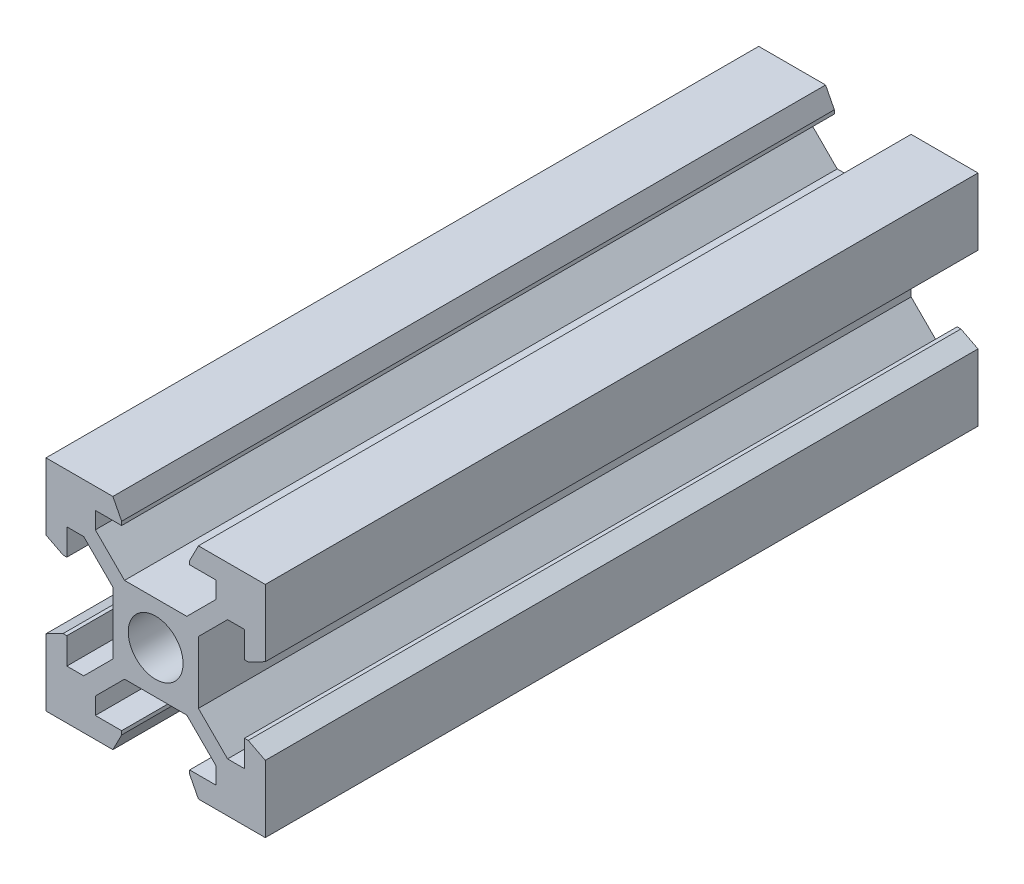
from build123d import *

# Parameters (mm, degrees)
SKETCH1_R           = 2.5
BOSS_EXTRUDE1_DEPTH = 65


with BuildPart() as part:
    # Sketch1 → Boss-Extrude1 (new body)
    with BuildSketch(Plane.XY):
        Polygon((6.1, 20), (0, 20), (0, 13.895792909), (1.56, 13.1), (1.9, 13.1), (1.9, 15.5), (3.439339828, 15.5), (6.1, 12.839339828), (6.1, 7.160660172), (3.439339828, 4.5), (1.9, 4.5), (1.9, 6.9), (1.56, 6.9), (0, 6.104207091), (0, 0), (6.1, 0), (6.9, 1.56), (6.9, 1.9), (4.5, 1.9), (4.5, 3.439339828), (7.160660172, 6.1), (12.839339828, 6.1), (15.5, 3.439339828), (15.5, 1.9), (13.1, 1.9), (13.1, 1.56), (13.9, 0), (20, 0), (20, 6.104207091), (18.44, 6.9), (18.1, 6.9), (18.1, 4.5), (16.560660172, 4.5), (13.9, 7.160660172), (13.9, 12.839339828), (16.560660172, 15.5), (18.1, 15.5), (18.1, 13.1), (18.44, 13.1), (20, 13.895792909), (20, 20), (13.9, 20), (13.1, 18.44), (13.1, 18.1), (15.5, 18.1), (15.5, 16.560660172), (12.839339828, 13.9), (7.160660172, 13.9), (4.5, 16.560660172), (4.5, 18.1), (6.9, 18.1), (6.9, 18.44), align=None)
        with Locations((10, 10)):
            Circle(SKETCH1_R, mode=Mode.SUBTRACT)
    extrude(amount=BOSS_EXTRUDE1_DEPTH)


solid = part.part
